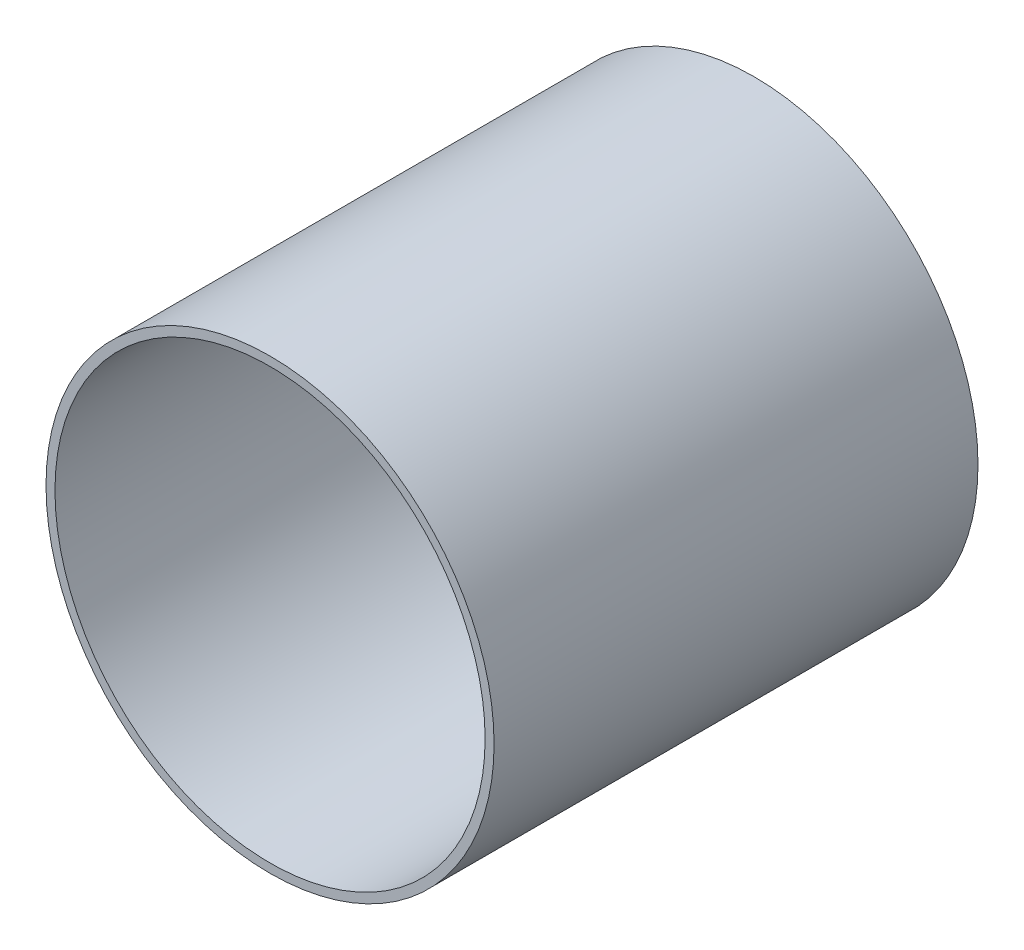
from build123d import *

# Parameters (mm, degrees)
SKETCH1_R           = 25
SKETCH1_R_2         = 24
BOSS_EXTRUDE1_DEPTH = 54


with BuildPart() as part:
    # Sketch1 → Boss-Extrude1 (new body)
    with BuildSketch(Plane.XY):
        Circle(SKETCH1_R)
        Circle(SKETCH1_R_2, mode=Mode.SUBTRACT)
    extrude(amount=BOSS_EXTRUDE1_DEPTH)


solid = part.part
